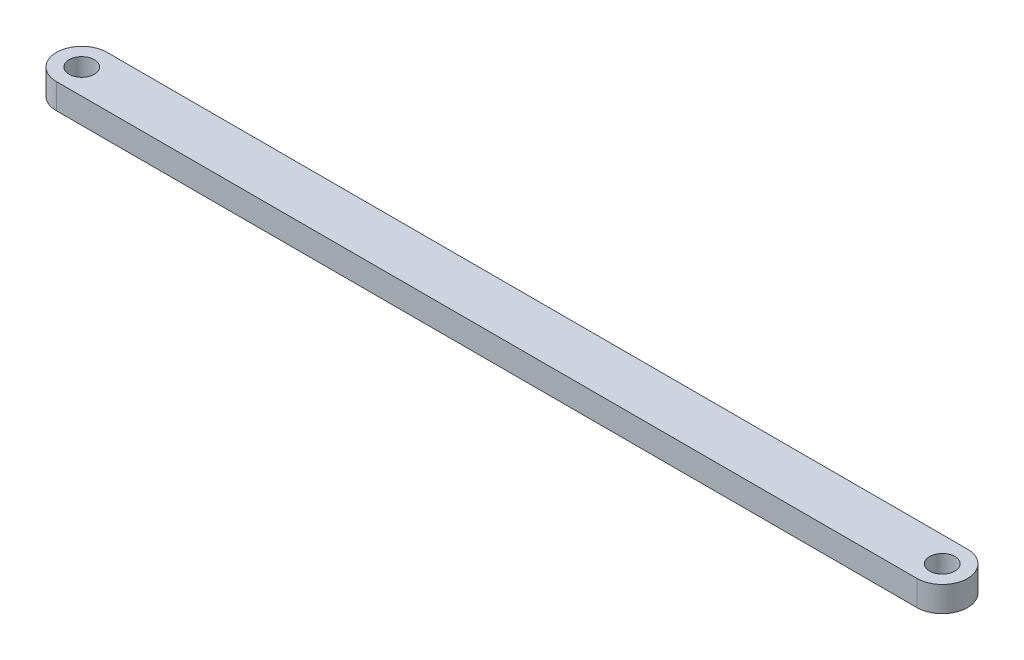
from build123d import *

# Parameters (mm, degrees)
BOSS_EXTRUDE1_DEPTH = 5
SKETCH2_R           = 2.5
CUT_EXTRUDE1_DEPTH  = 91.277350426


with BuildPart() as part:
    # Sketch1 → Boss-Extrude1 (new body)
    with BuildSketch(Plane(origin=(0, 0, 0), x_dir=(1, 0, 0), z_dir=(0, 1, 0))):
        with BuildLine():
            Line((-85, 5), (85, 5))
            ThreePointArc((85, 5), (90, 0), (85, -5))
            Line((85, -5), (-85, -5))
            ThreePointArc((-85, -5), (-90, 0), (-85, 5))
        make_face()
    extrude(amount=BOSS_EXTRUDE1_DEPTH)

    # Sketch2 → Cut-Extrude1 (cut, through all)
    with BuildSketch(Plane(origin=(0, 5, 0), x_dir=(1, 0, 0), z_dir=(0, 1, 0))):
        with Locations(Location((-85, 0, 0), (0, 0, 270))):
            Circle(SKETCH2_R)
        with Locations(Location((85, 0, 0), (0, 0, 270))):
            Circle(SKETCH2_R)
    extrude(amount=-CUT_EXTRUDE1_DEPTH, mode=Mode.SUBTRACT)


solid = part.part
